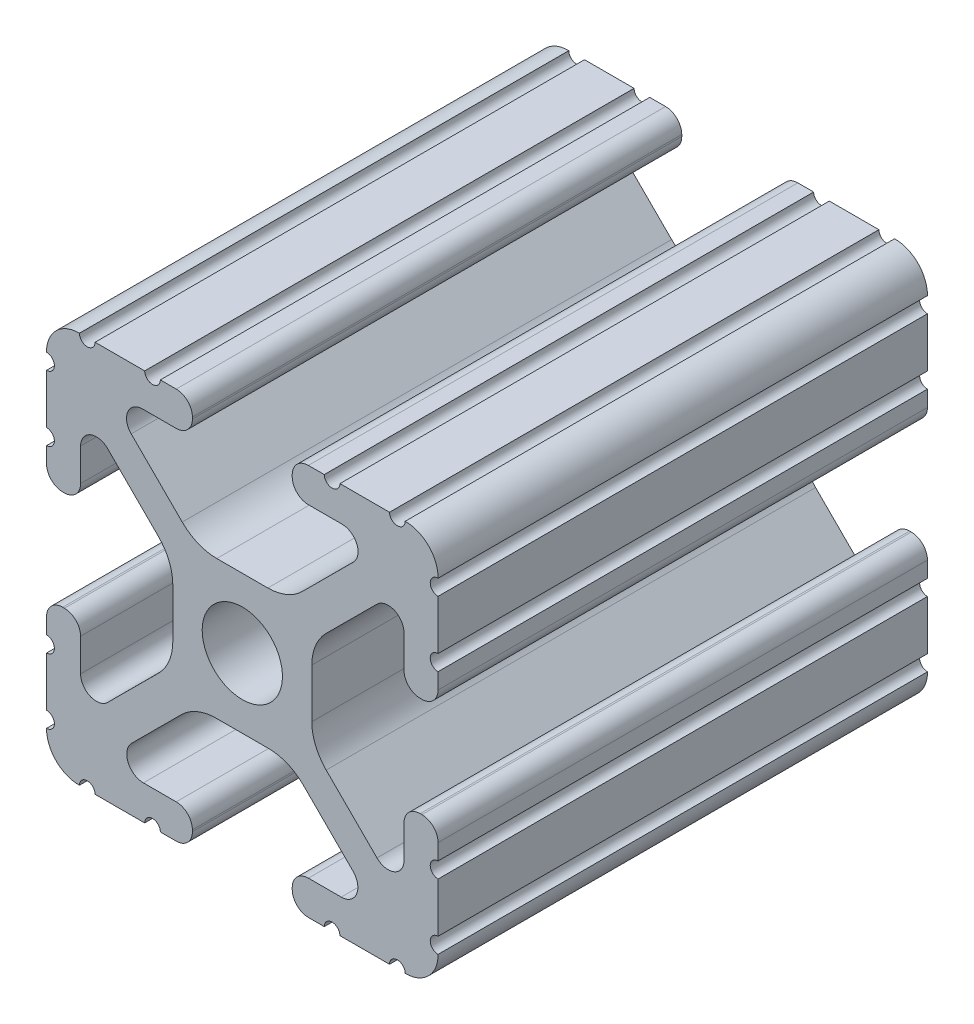
from build123d import *

# Parameters (mm, degrees)
SKETCH1_R           = 2.6035
BOSS_EXTRUDE1_DEPTH = 304.8
SKETCH2_R           = 24.282664684
CUT_EXTRUDE1_DEPTH  = 577.85


with BuildPart() as part:
    # Sketch1 → Boss-Extrude1 (new, symmetric)
    with BuildSketch(Plane.XY):
        with BuildLine():
            Line((-7.179650497, -8.645192506), (-3.952270251, -5.423690499))
            ThreePointArc((-3.952270251, -5.423690499), (-2.922936451, -4.736929036), (-1.709253557, -4.4958))
            Line((-1.709253557, -4.4958), (1.709253557, -4.4958))
            ThreePointArc((1.709253557, -4.4958), (2.922936451, -4.736929036), (3.952270251, -5.423690499))
            Line((3.952270251, -5.423690499), (7.179650497, -8.645192506))
            ThreePointArc((7.179650497, -8.645192506), (7.41473083, -9.822813117), (6.416408329, -10.4902))
            Line((6.416408329, -10.4902), (4.287512407, -10.4902))
            ThreePointArc((4.287512407, -10.4902), (3.54574862, -10.79744862), (3.2385, -11.539212407))
            Line((3.2385, -11.539212407), (3.2385, -11.650987593))
            ThreePointArc((3.2385, -11.650987593), (3.54574862, -12.39275138), (4.287512407, -12.7))
            Line((4.287512407, -12.7), (5.317126718, -12.7))
            ThreePointArc((5.317126718, -12.7), (5.825126718, -12.192), (6.333126718, -12.7))
            Line((6.333126718, -12.7), (9.550443118, -12.7))
            ThreePointArc((9.550443118, -12.7), (10.058366869, -12.192000006), (10.566443095, -12.699847501))
            ThreePointArc((10.566443095, -12.699847501), (12.082537762, -12.08250727), (12.699846982, -10.566399977))
            ThreePointArc((12.699846982, -10.566399977), (12.192000006, -10.058323491), (12.7, -9.5504))
            Line((12.7, -9.5504), (12.7, -6.3330836))
            ThreePointArc((12.7, -6.3330836), (12.192, -5.8250836), (12.7, -5.3170836))
            Line((12.7, -5.3170836), (12.7, -4.287469289))
            ThreePointArc((12.7, -4.287469289), (12.39275138, -3.545705502), (11.650987593, -3.238456882))
            Line((11.650987593, -3.238456882), (11.539212407, -3.238456882))
            ThreePointArc((11.539212407, -3.238456882), (10.79744862, -3.545705502), (10.4902, -4.287469289))
            Line((10.4902, -4.287469289), (10.4902, -6.402089023))
            ThreePointArc((10.4902, -6.402089023), (9.856505071, -7.351067942), (8.737131347, -7.129408934))
            Line((8.737131347, -7.129408934), (5.441005833, -3.840816462))
            ThreePointArc((5.441005833, -3.840816462), (4.750877967, -2.809883091), (4.5085, -1.593185507))
            Line((4.5085, -1.593185507), (4.5085, 1.593185507))
            ThreePointArc((4.5085, 1.593185507), (4.750877967, 2.809883091), (5.441005833, 3.840816462))
            Line((5.441005833, 3.840816462), (8.737131347, 7.129408934))
            ThreePointArc((8.737131347, 7.129408934), (9.856505071, 7.351067942), (10.4902, 6.402089023))
            Line((10.4902, 6.402089023), (10.4902, 4.287469289))
            ThreePointArc((10.4902, 4.287469289), (10.79744862, 3.545705502), (11.539212407, 3.238456882))
            Line((11.539212407, 3.238456882), (11.650987593, 3.238456882))
            ThreePointArc((11.650987593, 3.238456882), (12.39275138, 3.545705502), (12.7, 4.287469289))
            Line((12.7, 4.287469289), (12.7, 5.3170836))
            ThreePointArc((12.7, 5.3170836), (12.192, 5.8250836), (12.7, 6.3330836))
            Line((12.7, 6.3330836), (12.7, 9.5504))
            ThreePointArc((12.7, 9.5504), (12.192000006, 10.058323491), (12.699846982, 10.566399977))
            ThreePointArc((12.699846982, 10.566399977), (12.082537762, 12.08250727), (10.566443095, 12.699847501))
            ThreePointArc((10.566443095, 12.699847501), (10.058366869, 12.192000006), (9.550443118, 12.7))
            Line((9.550443118, 12.7), (6.333126718, 12.7))
            ThreePointArc((6.333126718, 12.7), (5.825126718, 12.192), (5.317126718, 12.7))
            Line((5.317126718, 12.7), (4.287512407, 12.7))
            ThreePointArc((4.287512407, 12.7), (3.54574862, 12.39275138), (3.2385, 11.650987593))
            Line((3.2385, 11.650987593), (3.2385, 11.539212407))
            ThreePointArc((3.2385, 11.539212407), (3.54574862, 10.79744862), (4.287512407, 10.4902))
            Line((4.287512407, 10.4902), (6.476788598, 10.4902))
            ThreePointArc((6.476788598, 10.4902), (7.432222385, 9.85140422), (7.207036008, 8.724370562))
            Line((7.207036008, 8.724370562), (3.898272566, 5.423169045))
            ThreePointArc((3.898272566, 5.423169045), (2.869120213, 4.736787962), (1.655778399, 4.4958))
            Line((1.655778399, 4.4958), (-1.655778399, 4.4958))
            ThreePointArc((-1.655778399, 4.4958), (-2.869120213, 4.736787962), (-3.898272566, 5.423169045))
            Line((-3.898272566, 5.423169045), (-7.207036008, 8.724370562))
            ThreePointArc((-7.207036008, 8.724370562), (-7.432222385, 9.85140422), (-6.476788598, 10.4902))
            Line((-6.476788598, 10.4902), (-4.287512407, 10.4902))
            ThreePointArc((-4.287512407, 10.4902), (-3.54574862, 10.79744862), (-3.2385, 11.539212407))
            Line((-3.2385, 11.539212407), (-3.2385, 11.650987593))
            ThreePointArc((-3.2385, 11.650987593), (-3.54574862, 12.39275138), (-4.287512407, 12.7))
            Line((-4.287512407, 12.7), (-5.317126718, 12.7))
            ThreePointArc((-5.317126718, 12.7), (-5.825126718, 12.192), (-6.333126718, 12.7))
            Line((-6.333126718, 12.7), (-9.550443118, 12.7))
            ThreePointArc((-9.550443118, 12.7), (-10.058366869, 12.192000006), (-10.566443095, 12.699847501))
            ThreePointArc((-10.566443095, 12.699847501), (-12.082537762, 12.08250727), (-12.699846982, 10.566399977))
            ThreePointArc((-12.699846982, 10.566399977), (-12.192000006, 10.058323491), (-12.7, 9.5504))
            Line((-12.7, 9.5504), (-12.7, 6.3330836))
            ThreePointArc((-12.7, 6.3330836), (-12.192, 5.8250836), (-12.7, 5.3170836))
            Line((-12.7, 5.3170836), (-12.7, 4.287469289))
            ThreePointArc((-12.7, 4.287469289), (-12.39275138, 3.545705502), (-11.650987593, 3.238456882))
            Line((-11.650987593, 3.238456882), (-11.539212407, 3.238456882))
            ThreePointArc((-11.539212407, 3.238456882), (-10.79744862, 3.545705502), (-10.4902, 4.287469289))
            Line((-10.4902, 4.287469289), (-10.4902, 6.402089023))
            ThreePointArc((-10.4902, 6.402089023), (-9.856505071, 7.351067942), (-8.737131347, 7.129408934))
            Line((-8.737131347, 7.129408934), (-5.441005833, 3.840816462))
            ThreePointArc((-5.441005833, 3.840816462), (-4.750877967, 2.809883091), (-4.5085, 1.593185507))
            Line((-4.5085, 1.593185507), (-4.5085, -1.593185507))
            ThreePointArc((-4.5085, -1.593185507), (-4.750877967, -2.809883091), (-5.441005833, -3.840816462))
            Line((-5.441005833, -3.840816462), (-8.737131347, -7.129408934))
            ThreePointArc((-8.737131347, -7.129408934), (-9.856505071, -7.351067942), (-10.4902, -6.402089023))
            Line((-10.4902, -6.402089023), (-10.4902, -4.287469289))
            ThreePointArc((-10.4902, -4.287469289), (-10.79744862, -3.545705502), (-11.539212407, -3.238456882))
            Line((-11.539212407, -3.238456882), (-11.650987593, -3.238456882))
            ThreePointArc((-11.650987593, -3.238456882), (-12.39275138, -3.545705502), (-12.7, -4.287469289))
            Line((-12.7, -4.287469289), (-12.7, -5.3170836))
            ThreePointArc((-12.7, -5.3170836), (-12.192, -5.8250836), (-12.7, -6.3330836))
            Line((-12.7, -6.3330836), (-12.7, -9.5504))
            ThreePointArc((-12.7, -9.5504), (-12.192000006, -10.058323491), (-12.699846982, -10.566399977))
            ThreePointArc((-12.699846982, -10.566399977), (-12.082537762, -12.08250727), (-10.566443095, -12.699847501))
            ThreePointArc((-10.566443095, -12.699847501), (-10.058366869, -12.192000006), (-9.550443118, -12.7))
            Line((-9.550443118, -12.7), (-6.333126718, -12.7))
            ThreePointArc((-6.333126718, -12.7), (-5.825126718, -12.192), (-5.317126718, -12.7))
            Line((-5.317126718, -12.7), (-4.287512407, -12.7))
            ThreePointArc((-4.287512407, -12.7), (-3.54574862, -12.39275138), (-3.2385, -11.650987593))
            Line((-3.2385, -11.650987593), (-3.2385, -11.539212407))
            ThreePointArc((-3.2385, -11.539212407), (-3.54574862, -10.79744862), (-4.287512407, -10.4902))
            Line((-4.287512407, -10.4902), (-6.416408329, -10.4902))
            ThreePointArc((-6.416408329, -10.4902), (-7.41473083, -9.822813117), (-7.179650497, -8.645192506))
        make_face()
        with Locations(Location((0, 0, 0), (0, 0, 180))):
            Circle(SKETCH1_R, mode=Mode.SUBTRACT)
    extrude(amount=BOSS_EXTRUDE1_DEPTH, both=True)

    # Sketch2 → Cut-Extrude1 (cut)
    with BuildSketch(Plane(origin=(0, 0, -304.8), x_dir=(-1, 0, 0), z_dir=(0, 0, -1))):
        Circle(SKETCH2_R)
    extrude(amount=-CUT_EXTRUDE1_DEPTH, mode=Mode.SUBTRACT)


solid = part.part
